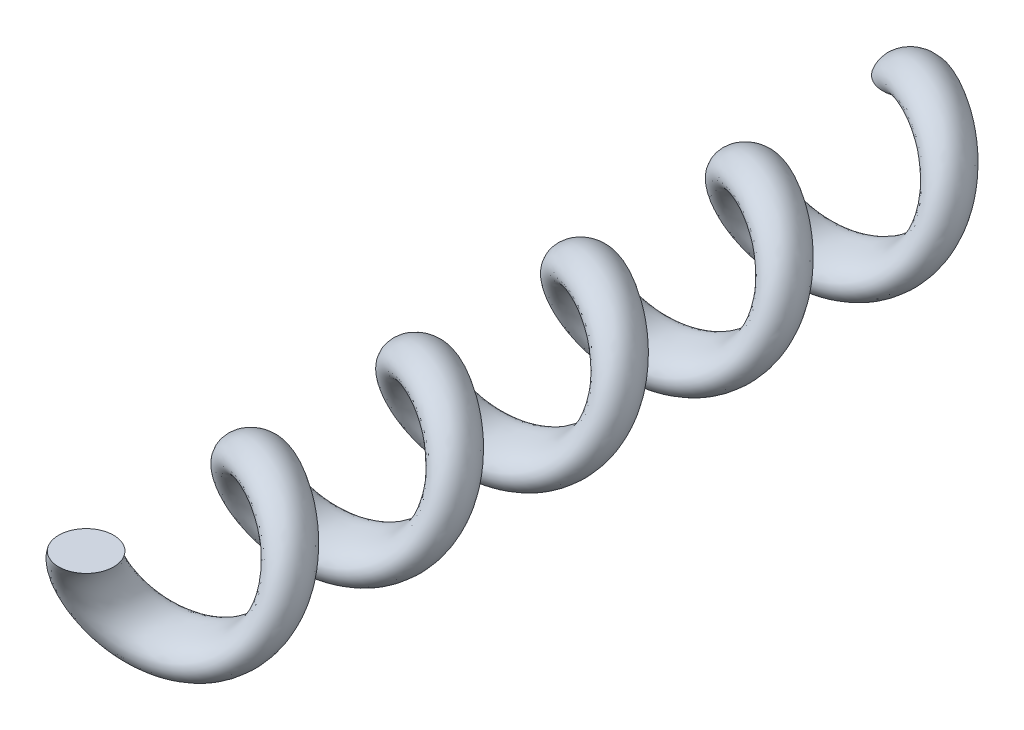
from build123d import *

# Parameters (mm, degrees)
SWEEP1_PITCH       = 6
SWEEP1_HEIGHT      = 30
SWEEP1_RADIUS      = 2
SWEEP1_START_ANGLE = 135
SKETCH2_R          = 1


with BuildPart() as part:
    # Sweep1: sweep along a helix
    with BuildLine() as sweep1_path:
        add(Helix(SWEEP1_PITCH, SWEEP1_HEIGHT, SWEEP1_RADIUS, center=(0, 0, 0), direction=(0, 0, 1), lefthand=True, mode=Mode.PRIVATE).rotate(Axis((0, 0, 0), (0, 0, 1)), SWEEP1_START_ANGLE))
    # Sketch2 → Sweep1 (sweep)
    with BuildSketch(Plane(origin=(0, 1.414213562, 0), x_dir=(1, 0, 0), z_dir=(0, 1, 0))):
        with Locations((-1.414213562, 0)):
            Circle(SKETCH2_R)
    sweep(path=sweep1_path.line, is_frenet=True)


solid = part.part
